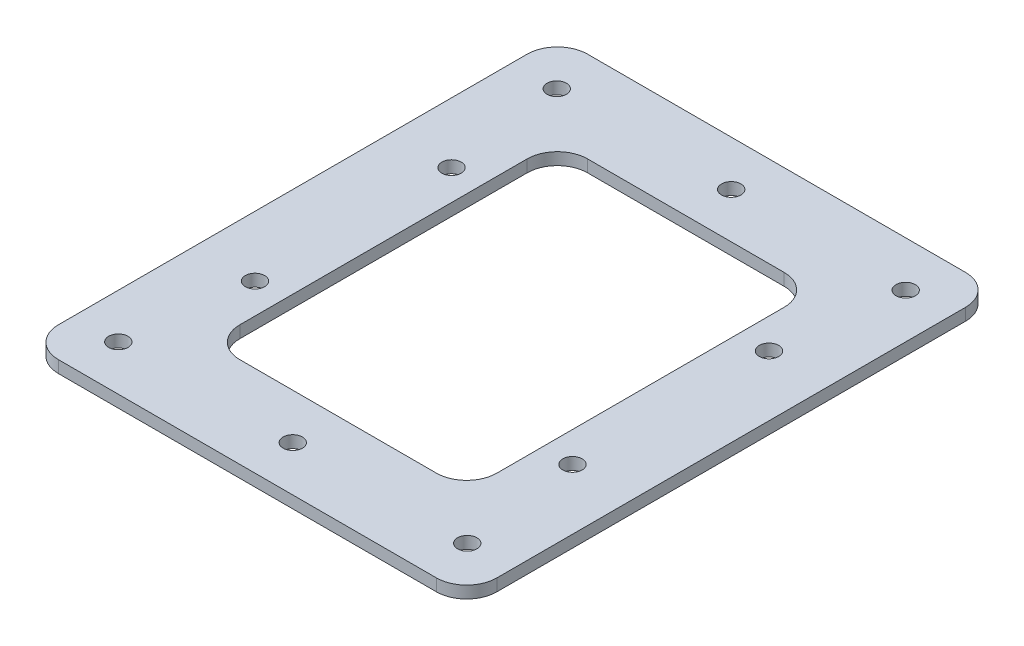
from build123d import *

# Parameters (mm, degrees)
SKETCH_1_W      = 72.5
SKETCH_1_H      = 87.5
SKETCH_1_R      = 1.6
SKETCH_1_W_2    = 42.5
SKETCH_1_H_2    = 57.5
EXTRUDE_1_DEPTH = 2
FILLET_1_R      = 5


with BuildPart() as part:
    # 草图1 → 凸台-拉伸1 (new body)
    with BuildSketch(Plane(origin=(0, 0, 0), x_dir=(1, 0, 0), z_dir=(0, 1, 0))):
        with Locations((21.25, 28.75)):
            Rectangle(SKETCH_1_W, SKETCH_1_H)
        with Locations(Location((-7.6, 65, 0), (0, 0, 270))):
            Circle(SKETCH_1_R, mode=Mode.SUBTRACT)
        with Locations(Location((21.25, 65, 0), (0, 0, 270))):
            Circle(SKETCH_1_R, mode=Mode.SUBTRACT)
        with Locations(Location((50.1, 65, 0), (0, 0, 270))):
            Circle(SKETCH_1_R, mode=Mode.SUBTRACT)
        with Locations(Location((50.1, -7.5, 0), (0, 0, 270))):
            Circle(SKETCH_1_R, mode=Mode.SUBTRACT)
        with Locations(Location((21.25, -7.5, 0), (0, 0, 270))):
            Circle(SKETCH_1_R, mode=Mode.SUBTRACT)
        with Locations(Location((-7.6, -7.5, 0), (0, 0, 270))):
            Circle(SKETCH_1_R, mode=Mode.SUBTRACT)
        with Locations(Location((-5, 45, 0), (0, 0, 270))):
            Circle(SKETCH_1_R, mode=Mode.SUBTRACT)
        with Locations(Location((-5, 12.5, 0), (0, 0, 270))):
            Circle(SKETCH_1_R, mode=Mode.SUBTRACT)
        with Locations(Location((47.5, 12.5, 0), (0, 0, 90))):
            Circle(SKETCH_1_R, mode=Mode.SUBTRACT)
        with Locations(Location((47.5, 45, 0), (0, 0, 90))):
            Circle(SKETCH_1_R, mode=Mode.SUBTRACT)
        with Locations((21.25, 28.75)):
            Rectangle(SKETCH_1_W_2, SKETCH_1_H_2, mode=Mode.SUBTRACT)
    extrude(amount=EXTRUDE_1_DEPTH)

    # 圆角1
    fillet_1_edges = [part.edges().sort_by_distance(p)[0] for p in [
        (0, 1, -57.5),
        (0, 1, 0),
        (42.5, 1, 0),
        (42.5, 1, -57.5),
        (-15, 1, 15),
        (-15, 1, -72.5),
        (57.5, 1, -72.5),
        (57.5, 1, 15),
    ]]
    fillet(fillet_1_edges, radius=FILLET_1_R)


solid = part.part
